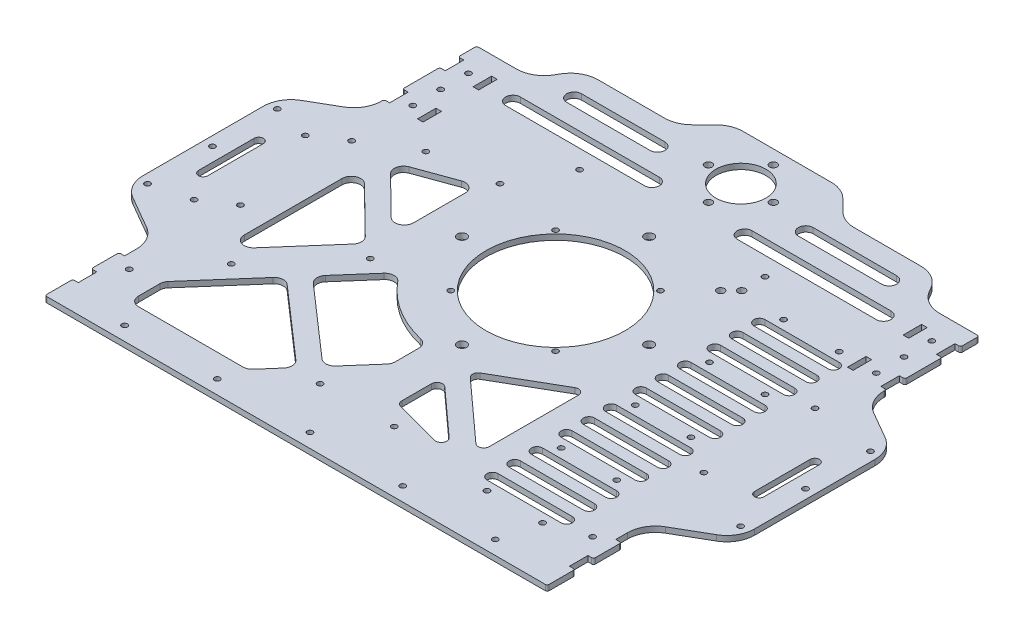
from build123d import *

# Parameters (mm, degrees)
SKETCH_1_R      = 1.5
SKETCH_1_R_2    = 13.5
SKETCH_1_R_3    = 2
SKETCH_1_R_4    = 37.5
SKETCH_1_R_5    = 2.5
SKETCH_1_W      = 3
SKETCH_1_H      = 10
EXTRUDE_1_DEPTH = 3
FILLET_1_R      = 15
FILLET_2_R      = 1


with BuildPart() as part:
    # 草图1 → 凸台-拉伸1 (new body)
    with BuildSketch(Plane(origin=(0, 0, 0), x_dir=(1, 0, 0), z_dir=(0, 1, 0))):
        Polygon((-135.5, -140), (135.5, -140), (135.5, -125), (132.5, -125), (132.5, -115), (135.5, -115), (135.5, -100), (132.5, -100), (132.5, -85), (165, -66.236116251), (165, 15.968167059), (135.5, 33), (135.5, 43), (132.5, 43), (132.5, 53), (135.5, 53), (135.5, 73), (132.5, 73), (132.5, 83), (135.5, 83), (135.5, 93), (105.5, 93), (95.685045424, 110), (45, 110), (30, 125), (-30, 125), (-45, 110), (-95.685045424, 110), (-105.5, 93), (-135.5, 93), (-135.5, 83), (-132.5, 83), (-132.5, 73), (-135.5, 73), (-135.5, 53), (-132.5, 53), (-132.5, 43), (-135.5, 43), (-135.5, 33), (-165, 15.968167059), (-165, -66.236116251), (-132.5, -85), (-132.5, -100), (-135.5, -100), (-135.5, -115), (-132.5, -115), (-132.5, -125), (-135.5, -125), align=None)
        with Locations(Location((125, 78, 0), (0, 0, 270))):
            Circle(SKETCH_1_R, mode=Mode.SUBTRACT)
        with Locations(Location((0, 100, 0), (0, 0, 270))):
            Circle(SKETCH_1_R_2, mode=Mode.SUBTRACT)
        with Locations(Location((0, 117.5, 0), (0, 0, 270))):
            Circle(SKETCH_1_R_3, mode=Mode.SUBTRACT)
        with Locations(Location((17.5, 100, 0), (0, 0, 270))):
            Circle(SKETCH_1_R_3, mode=Mode.SUBTRACT)
        with Locations(Location((0, 82.5, 0), (0, 0, 270))):
            Circle(SKETCH_1_R_3, mode=Mode.SUBTRACT)
        with Locations(Location((-17.5, 100, 0), (0, 0, 270))):
            Circle(SKETCH_1_R_3, mode=Mode.SUBTRACT)
        with Locations(Location((44.547727215, 44.547727215, 0), (0, 0, 270))):
            Circle(SKETCH_1_R_3, mode=Mode.SUBTRACT)
        with Locations(Location((50.204581464, 50.204581464, 0), (0, 0, 270))):
            Circle(SKETCH_1_R_3, mode=Mode.SUBTRACT)
        with Locations(Location((100, -132.5, 0), (0, 0, 270))):
            Circle(SKETCH_1_R, mode=Mode.SUBTRACT)
        with Locations(Location((50, -132.5, 0), (0, 0, 270))):
            Circle(SKETCH_1_R, mode=Mode.SUBTRACT)
        with Locations(Location((0, -132.5, 0), (0, 0, 270))):
            Circle(SKETCH_1_R, mode=Mode.SUBTRACT)
        with Locations(Location((-50, -132.5, 0), (0, 0, 270))):
            Circle(SKETCH_1_R, mode=Mode.SUBTRACT)
        with Locations(Location((-100, -132.5, 0), (0, 0, 270))):
            Circle(SKETCH_1_R, mode=Mode.SUBTRACT)
        with Locations(Location((125, -105, 0), (0, 0, 270))):
            Circle(SKETCH_1_R, mode=Mode.SUBTRACT)
        with Locations(Location((125, -45, 0), (0, 0, 270))):
            Circle(SKETCH_1_R, mode=Mode.SUBTRACT)
        with Locations(Location((125, 15, 0), (0, 0, 270))):
            Circle(SKETCH_1_R, mode=Mode.SUBTRACT)
        with Locations(Location((-125, 78, 0), (0, 0, 270))):
            Circle(SKETCH_1_R, mode=Mode.SUBTRACT)
        with Locations(Location((-125, 15, 0), (0, 0, 90))):
            Circle(SKETCH_1_R, mode=Mode.SUBTRACT)
        with Locations(Location((-125, -45, 0), (0, 0, 90))):
            Circle(SKETCH_1_R, mode=Mode.SUBTRACT)
        with Locations(Location((-125, -105, 0), (0, 0, 90))):
            Circle(SKETCH_1_R, mode=Mode.SUBTRACT)
        with Locations(Location((125, 48, 0), (0, 0, 270))):
            Circle(SKETCH_1_R, mode=Mode.SUBTRACT)
        with Locations(Location((-125, 48, 0), (0, 0, 90))):
            Circle(SKETCH_1_R, mode=Mode.SUBTRACT)
        with Locations(Location((0, 0, 0), (0, 0, 270))):
            Circle(SKETCH_1_R_4, mode=Mode.SUBTRACT)
        with Locations(Location((50.5, 0, 0), (0, 0, 270))):
            Circle(SKETCH_1_R_5, mode=Mode.SUBTRACT)
        with Locations(Location((0, -50.5, 0), (0, 0, 270))):
            Circle(SKETCH_1_R_5, mode=Mode.SUBTRACT)
        with Locations(Location((-50.5, 0, 0), (0, 0, 270))):
            Circle(SKETCH_1_R_5, mode=Mode.SUBTRACT)
        with Locations(Location((0, 50.5, 0), (0, 0, 270))):
            Circle(SKETCH_1_R_5, mode=Mode.SUBTRACT)
        with Locations(Location((125, 63, 0), (0, 0, 270))):
            Circle(SKETCH_1_R, mode=Mode.SUBTRACT)
        with Locations(Location((-125, 63, 0), (0, 0, 90))):
            Circle(SKETCH_1_R, mode=Mode.SUBTRACT)
        with Locations(Location((-100, 30, 0), (0, 0, 270))):
            Circle(SKETCH_1_R, mode=Mode.SUBTRACT)
        with Locations(Location((50, 63, 0), (0, 0, 270))):
            Circle(SKETCH_1_R, mode=Mode.SUBTRACT)
        with Locations(Location((-50, 63, 0), (0, 0, 270))):
            Circle(SKETCH_1_R, mode=Mode.SUBTRACT)
        with Locations(Location((-100, -75, 0), (0, 0, 270))):
            Circle(SKETCH_1_R, mode=Mode.SUBTRACT)
        with Locations(Location((-65, 35, 0), (0, 0, 270))):
            Circle(SKETCH_1_R, mode=Mode.SUBTRACT)
        with Locations(Location((-65, -35, 0), (0, 0, 270))):
            Circle(SKETCH_1_R, mode=Mode.SUBTRACT)
        with Locations(Location((-140, 5, 0), (0, 0, 270))):
            Circle(SKETCH_1_R, mode=Mode.SUBTRACT)
        with Locations(Location((-140, -55, 0), (0, 0, 270))):
            Circle(SKETCH_1_R, mode=Mode.SUBTRACT)
        with Locations(Location((-160, 9.866025404, 0), (0, 0, 270))):
            Circle(SKETCH_1_R, mode=Mode.SUBTRACT)
        with Locations(Location((-160, -25.133974596, 0), (0, 0, 270))):
            Circle(SKETCH_1_R, mode=Mode.SUBTRACT)
        with Locations(Location((-160, -60.133974596, 0), (0, 0, 270))):
            Circle(SKETCH_1_R, mode=Mode.SUBTRACT)
        with Locations(Location((160, 9.866025404, 0), (0, 0, 90))):
            Circle(SKETCH_1_R, mode=Mode.SUBTRACT)
        with Locations(Location((160, -60.133974596, 0), (0, 0, 90))):
            Circle(SKETCH_1_R, mode=Mode.SUBTRACT)
        with Locations(Location((160, -25.133974596, 0), (0, 0, 90))):
            Circle(SKETCH_1_R, mode=Mode.SUBTRACT)
        with Locations(Location((28.284271247, -28.284271247, 0), (0, 0, 270))):
            Circle(SKETCH_1_R, mode=Mode.SUBTRACT)
        with Locations(Location((-28.284271247, -28.284271247, 0), (0, 0, 270))):
            Circle(SKETCH_1_R, mode=Mode.SUBTRACT)
        with Locations(Location((-28.284271247, 28.284271247, 0), (0, 0, 270))):
            Circle(SKETCH_1_R, mode=Mode.SUBTRACT)
        with Locations(Location((28.284271247, 28.284271247, 0), (0, 0, 270))):
            Circle(SKETCH_1_R, mode=Mode.SUBTRACT)
        with Locations(Location((105, 48, 0), (0, 0, 270))):
            Circle(SKETCH_1_R, mode=Mode.SUBTRACT)
        with Locations(Location((75, 48, 0), (0, 0, 270))):
            Circle(SKETCH_1_R, mode=Mode.SUBTRACT)
        with Locations(Location((75, 8, 0), (0, 0, 270))):
            Circle(SKETCH_1_R, mode=Mode.SUBTRACT)
        with Locations(Location((75, -32, 0), (0, 0, 270))):
            Circle(SKETCH_1_R, mode=Mode.SUBTRACT)
        with Locations(Location((75, -72, 0), (0, 0, 270))):
            Circle(SKETCH_1_R, mode=Mode.SUBTRACT)
        with Locations(Location((75, -112, 0), (0, 0, 270))):
            Circle(SKETCH_1_R, mode=Mode.SUBTRACT)
        with Locations(Location((105, 8, 0), (0, 0, 270))):
            Circle(SKETCH_1_R, mode=Mode.SUBTRACT)
        with Locations(Location((105, -32, 0), (0, 0, 270))):
            Circle(SKETCH_1_R, mode=Mode.SUBTRACT)
        with Locations(Location((105, -72, 0), (0, 0, 270))):
            Circle(SKETCH_1_R, mode=Mode.SUBTRACT)
        with Locations(Location((105, -112, 0), (0, 0, 270))):
            Circle(SKETCH_1_R, mode=Mode.SUBTRACT)
        with Locations(Location((20, -107, 0), (0, 0, 270))):
            Circle(SKETCH_1_R, mode=Mode.SUBTRACT)
        with Locations(Location((-20, -107, 0), (0, 0, 270))):
            Circle(SKETCH_1_R, mode=Mode.SUBTRACT)
        with Locations((116, 48)):
            Rectangle(SKETCH_1_W, SKETCH_1_H, mode=Mode.SUBTRACT)
        with Locations((116, 78)):
            Rectangle(SKETCH_1_W, SKETCH_1_H, mode=Mode.SUBTRACT)
        with Locations((-116, 78)):
            Rectangle(SKETCH_1_W, SKETCH_1_H, mode=Mode.SUBTRACT)
        with Locations((-116, 48)):
            Rectangle(SKETCH_1_W, SKETCH_1_H, mode=Mode.SUBTRACT)
        with BuildLine():
            Line((-152.5, -40.133974596), (-152.5, -10.133974596))
            ThreePointArc((-152.5, -10.133974596), (-150, -7.633974596), (-147.5, -10.133974596))
            Line((-147.5, -10.133974596), (-147.5, -40.133974596))
            ThreePointArc((-147.5, -40.133974596), (-150, -42.633974596), (-152.5, -40.133974596))
        make_face(mode=Mode.SUBTRACT)
        with BuildLine():
            Line((-10, -63.759313045), (-10, -76.56563969))
            ThreePointArc((-10, -76.56563969), (-10.31948628, -78.324273056), (-11.237116526, -79.858162729))
            Line((-11.237116526, -79.858162729), (-24.008921575, -94.454511356))
            ThreePointArc((-24.008921575, -94.454511356), (-27.439209996, -96.150914106), (-31.064328088, -94.92487179))
            Line((-31.064328088, -94.92487179), (-68.693162823, -61.999641397))
            ThreePointArc((-68.693162823, -61.999641397), (-70.389565573, -58.569352976), (-69.163523257, -54.944234884))
            Line((-69.163523257, -54.944234884), (-54.47723868, -38.159909652))
            ThreePointArc((-54.47723868, -38.159909652), (-50.630392917, -36.453137708), (-46.843030381, -38.288124852))
            ThreePointArc((-46.843030381, -38.288124852), (-32.049858641, -51.31331758), (-13.854961832, -58.892189912))
            ThreePointArc((-13.854961832, -58.892189912), (-11.080485308, -60.654896098), (-10, -63.759313045))
        make_face(mode=Mode.SUBTRACT)
        with BuildLine():
            Line((-48.630065272, -120), (-105, -120))
            ThreePointArc((-105, -120), (-108.535533906, -118.535533906), (-110, -115))
            Line((-110, -115), (-110, -103.493169599))
            ThreePointArc((-110, -103.493169599), (-109.68051372, -101.734536233), (-108.762883474, -100.200646559))
            Line((-108.762883474, -100.200646559), (-82.333615415, -69.995768778))
            ThreePointArc((-82.333615415, -69.995768778), (-78.903326994, -68.299366028), (-75.278208902, -69.525408344))
            Line((-75.278208902, -69.525408344), (-37.649374167, -102.450638737))
            ThreePointArc((-37.649374167, -102.450638737), (-35.952971417, -105.880927158), (-37.179013732, -109.50604525))
            Line((-37.179013732, -109.50604525), (-44.867181798, -118.292523039))
            ThreePointArc((-44.867181798, -118.292523039), (-46.563983859, -119.55316457), (-48.630065272, -120))
        make_face(mode=Mode.SUBTRACT)
        with BuildLine():
            Line((-97.344796412, 18.363468575), (-76.710100717, 25.873883602))
            ThreePointArc((-76.710100717, 25.873883602), (-72.132117818, 25.271180719), (-70, 21.175420498))
            Line((-70, 21.175420498), (-70, -6.601213515))
            ThreePointArc((-70, -6.601213515), (-73.065794785, -11.211945581), (-78.503540074, -10.168454318))
            Line((-78.503540074, -10.168454318), (-99.13823577, 10.097764669))
            ThreePointArc((-99.13823577, 10.097764669), (-100.521000828, 14.725204583), (-97.344796412, 18.363468575))
        make_face(mode=Mode.SUBTRACT)
        with BuildLine():
            Line((-76.406244347, -32.849785235), (-101.237116527, -61.227924869))
            ThreePointArc((-101.237116527, -61.227924869), (-106.758633366, -62.61591555), (-110, -57.93540183))
            Line((-110, -57.93540183), (-110, -5.169798448))
            ThreePointArc((-110, -5.169798448), (-106.934205215, -0.559066382), (-101.496459926, -1.602557645))
            Line((-101.496459926, -1.602557645), (-76.665587746, -25.990021393))
            ThreePointArc((-76.665587746, -25.990021393), (-75.172697316, -29.368364838), (-76.406244347, -32.849785235))
        make_face(mode=Mode.SUBTRACT)
        with BuildLine():
            Line((-85, 99), (-40, 99))
            ThreePointArc((-40, 99), (-36, 95), (-40, 91))
            Line((-40, 91), (-85, 91))
            ThreePointArc((-85, 91), (-89, 95), (-85, 99))
        make_face(mode=Mode.SUBTRACT)
        with BuildLine():
            Line((-100, 81), (-25, 81))
            ThreePointArc((-25, 81), (-21, 77), (-25, 73))
            Line((-25, 73), (-100, 73))
            ThreePointArc((-100, 73), (-104, 77), (-100, 81))
        make_face(mode=Mode.SUBTRACT)
        with BuildLine():
            Line((85, 99), (40, 99))
            ThreePointArc((40, 99), (36, 95), (40, 91))
            Line((40, 91), (85, 91))
            ThreePointArc((85, 91), (89, 95), (85, 99))
        make_face(mode=Mode.SUBTRACT)
        with BuildLine():
            Line((100, 81), (25, 81))
            ThreePointArc((25, 81), (21, 77), (25, 73))
            Line((25, 73), (100, 73))
            ThreePointArc((100, 73), (104, 77), (100, 81))
        make_face(mode=Mode.SUBTRACT)
        with BuildLine():
            Line((70, 43), (110, 43))
            ThreePointArc((110, 43), (113, 40), (110, 37))
            Line((110, 37), (70, 37))
            ThreePointArc((70, 37), (67, 40), (70, 43))
        make_face(mode=Mode.SUBTRACT)
        with BuildLine():
            Line((70, 31), (110, 31))
            ThreePointArc((110, 31), (113, 28), (110, 25))
            Line((110, 25), (70, 25))
            ThreePointArc((70, 25), (67, 28), (70, 31))
        make_face(mode=Mode.SUBTRACT)
        with BuildLine():
            Line((70, 19), (110, 19))
            ThreePointArc((110, 19), (113, 16), (110, 13))
            Line((110, 13), (70, 13))
            ThreePointArc((70, 13), (67, 16), (70, 19))
        make_face(mode=Mode.SUBTRACT)
        with BuildLine():
            Line((70, 3), (110, 3))
            ThreePointArc((110, 3), (113, 0), (110, -3))
            Line((110, -3), (70, -3))
            ThreePointArc((70, -3), (67, 0), (70, 3))
        make_face(mode=Mode.SUBTRACT)
        with BuildLine():
            Line((70, -9), (110, -9))
            ThreePointArc((110, -9), (113, -12), (110, -15))
            Line((110, -15), (70, -15))
            ThreePointArc((70, -15), (67, -12), (70, -9))
        make_face(mode=Mode.SUBTRACT)
        with BuildLine():
            Line((70, -21), (110, -21))
            ThreePointArc((110, -21), (113, -24), (110, -27))
            Line((110, -27), (70, -27))
            ThreePointArc((70, -27), (67, -24), (70, -21))
        make_face(mode=Mode.SUBTRACT)
        with BuildLine():
            Line((70, -37), (110, -37))
            ThreePointArc((110, -37), (113, -40), (110, -43))
            Line((110, -43), (70, -43))
            ThreePointArc((70, -43), (67, -40), (70, -37))
        make_face(mode=Mode.SUBTRACT)
        with BuildLine():
            Line((70, -49), (110, -49))
            ThreePointArc((110, -49), (113, -52), (110, -55))
            Line((110, -55), (70, -55))
            ThreePointArc((70, -55), (67, -52), (70, -49))
        make_face(mode=Mode.SUBTRACT)
        with BuildLine():
            Line((70, -61), (110, -61))
            ThreePointArc((110, -61), (113, -64), (110, -67))
            Line((110, -67), (70, -67))
            ThreePointArc((70, -67), (67, -64), (70, -61))
        make_face(mode=Mode.SUBTRACT)
        with BuildLine():
            Line((70, -77), (110, -77))
            ThreePointArc((110, -77), (113, -80), (110, -83))
            Line((110, -83), (70, -83))
            ThreePointArc((70, -83), (67, -80), (70, -77))
        make_face(mode=Mode.SUBTRACT)
        with BuildLine():
            Line((70, -89), (110, -89))
            ThreePointArc((110, -89), (113, -92), (110, -95))
            Line((110, -95), (70, -95))
            ThreePointArc((70, -95), (67, -92), (70, -89))
        make_face(mode=Mode.SUBTRACT)
        with BuildLine():
            Line((70, -101), (110, -101))
            ThreePointArc((110, -101), (113, -104), (110, -107))
            Line((110, -107), (70, -107))
            ThreePointArc((70, -107), (67, -104), (70, -101))
        make_face(mode=Mode.SUBTRACT)
        with BuildLine():
            Line((50.5, -40.098076211), (18.113077914, -58.796674396))
            ThreePointArc((18.113077914, -58.796674396), (16.629990918, -61.076643749), (17.598937557, -63.618090128))
            Line((17.598937557, -63.618090128), (49.985859643, -92.95765172))
            ThreePointArc((49.985859643, -92.95765172), (53.216054877, -93.476794749), (55, -90.7343122))
            Line((55, -90.7343122), (55, -42.696152423))
            ThreePointArc((55, -42.696152423), (53.5, -40.098076211), (50.5, -40.098076211))
        make_face(mode=Mode.SUBTRACT)
        with BuildLine():
            Line((10, -76.993057826), (10, -92.925389061))
            ThreePointArc((10, -92.925389061), (10.619939979, -94.751673349), (12.223542865, -95.82316654))
            Line((12.223542865, -95.82316654), (37.197473671, -102.514911132))
            ThreePointArc((37.197473671, -102.514911132), (40.608209601, -101.052604039), (39.988071163, -97.393794132))
            Line((39.988071163, -97.393794132), (15.014140357, -74.769718305))
            ThreePointArc((15.014140357, -74.769718305), (11.783945123, -74.250575276), (10, -76.993057826))
        make_face(mode=Mode.SUBTRACT)
        with BuildLine():
            Line((152.5, -40.133974596), (152.5, -10.133974596))
            ThreePointArc((152.5, -10.133974596), (150, -7.633974596), (147.5, -10.133974596))
            Line((147.5, -10.133974596), (147.5, -40.133974596))
            ThreePointArc((147.5, -40.133974596), (150, -42.633974596), (152.5, -40.133974596))
        make_face(mode=Mode.SUBTRACT)
    extrude(amount=EXTRUDE_1_DEPTH)

    # 圆角1
    fillet_1_edges = [part.edges().sort_by_distance(p)[0] for p in [
        (-132.5, 1.5, 85),
        (-165, 1.5, 66.236116251),
        (-165, 1.5, -15.968167059),
        (-135.5, 1.5, -33),
        (-105.5, 1.5, -93),
        (-95.685045424, 1.5, -110),
        (-45, 1.5, -110),
        (-30, 1.5, -125),
        (30, 1.5, -125),
        (45, 1.5, -110),
        (95.685045424, 1.5, -110),
        (105.5, 1.5, -93),
        (135.5, 1.5, -33),
        (165, 1.5, -15.968167059),
        (165, 1.5, 66.236116251),
        (132.5, 1.5, 85),
    ]]
    fillet(fillet_1_edges, radius=FILLET_1_R)

    # 圆角2
    fillet_2_edges = [part.edges().sort_by_distance(p)[0] for p in [
        (135.5, 1.5, 125),
        (135.5, 1.5, 140),
        (-135.5, 1.5, 140),
        (-135.5, 1.5, 125),
        (-135.5, 1.5, 115),
        (-135.5, 1.5, 100),
        (-135.5, 1.5, -43),
        (-135.5, 1.5, -53),
        (-135.5, 1.5, -73),
        (-135.5, 1.5, -83),
        (-135.5, 1.5, -93),
        (135.5, 1.5, -93),
        (135.5, 1.5, -83),
        (135.5, 1.5, -73),
        (135.5, 1.5, -53),
        (135.5, 1.5, -43),
        (135.5, 1.5, 100),
        (135.5, 1.5, 115),
    ]]
    fillet(fillet_2_edges, radius=FILLET_2_R)


solid = part.part
